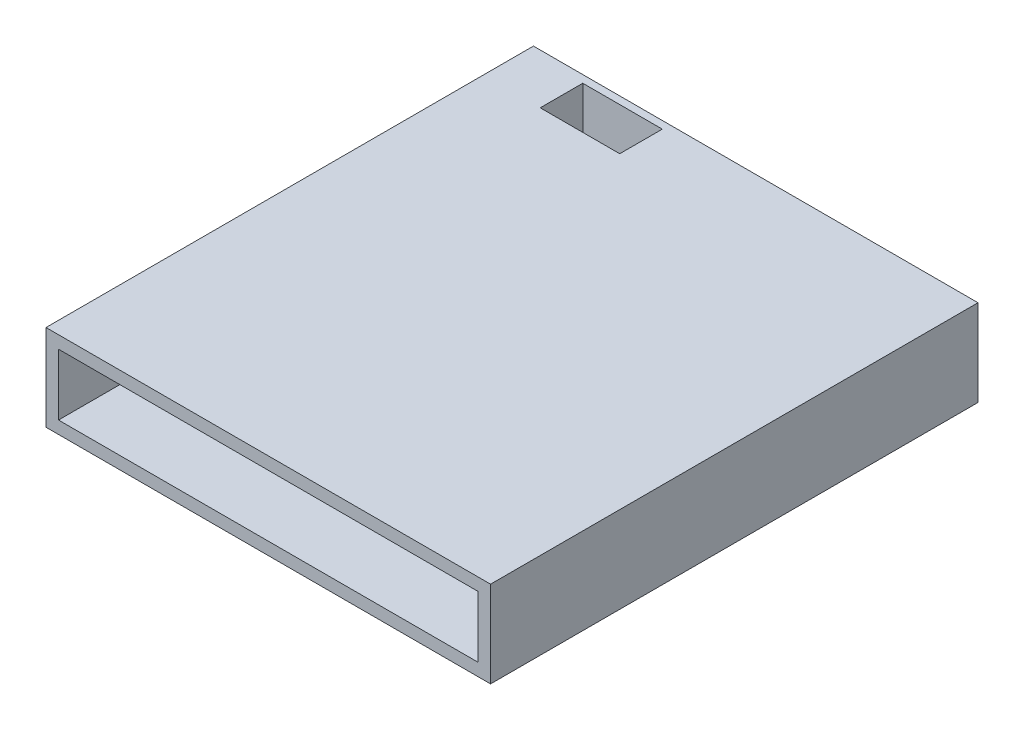
from build123d import *

# Parameters (mm, degrees)
SKETCH1_W                = 71
SKETCH1_H                = 13.8
SKETCH1_W_2              = 67
SKETCH1_H_2              = 9.8
EXTRUDE_THIN1_DEPTH      = 69.85
BOSS_EXTRUDE2_DEPTH      = 11.55
BOSS_EXTRUDE2_DEPTH_BACK = 2.25
SKETCH5_W                = 71
SKETCH5_H                = 8
SKETCH6_W                = 12.7
SKETCH6_H                = 9.856323991
CUT_EXTRUDE1_DEPTH       = 6.8


with BuildPart() as part:
    # Sketch1 → Extrude-Thin1 (new body)
    with BuildSketch(Plane.XY):
        with Locations((33.25, 4.65)):
            Rectangle(SKETCH1_W, SKETCH1_H)
        with Locations((33.25, 4.65)):
            Rectangle(SKETCH1_W_2, SKETCH1_H_2, mode=Mode.SUBTRACT)
    extrude(amount=EXTRUDE_THIN1_DEPTH)

    # Sketch5 → Boss-Extrude2 (add, two sides: drawn at the far end of the back side and taken through both)
    with BuildSketch(Plane(origin=(0, 0, 0), x_dir=(1, 0, 0), z_dir=(0, 1, 0)).offset(-BOSS_EXTRUDE2_DEPTH_BACK)):
        with Locations((33.25, 4)):
            Rectangle(SKETCH5_W, SKETCH5_H)
    extrude(amount=BOSS_EXTRUDE2_DEPTH + BOSS_EXTRUDE2_DEPTH_BACK)

    # Sketch6 → Cut-Extrude1 (cut)
    with BuildSketch(Plane.XY):
        with Locations((13.18, 6.988161996)):
            Rectangle(SKETCH6_W, SKETCH6_H)
    extrude(amount=-CUT_EXTRUDE1_DEPTH, mode=Mode.SUBTRACT)


solid = part.part
